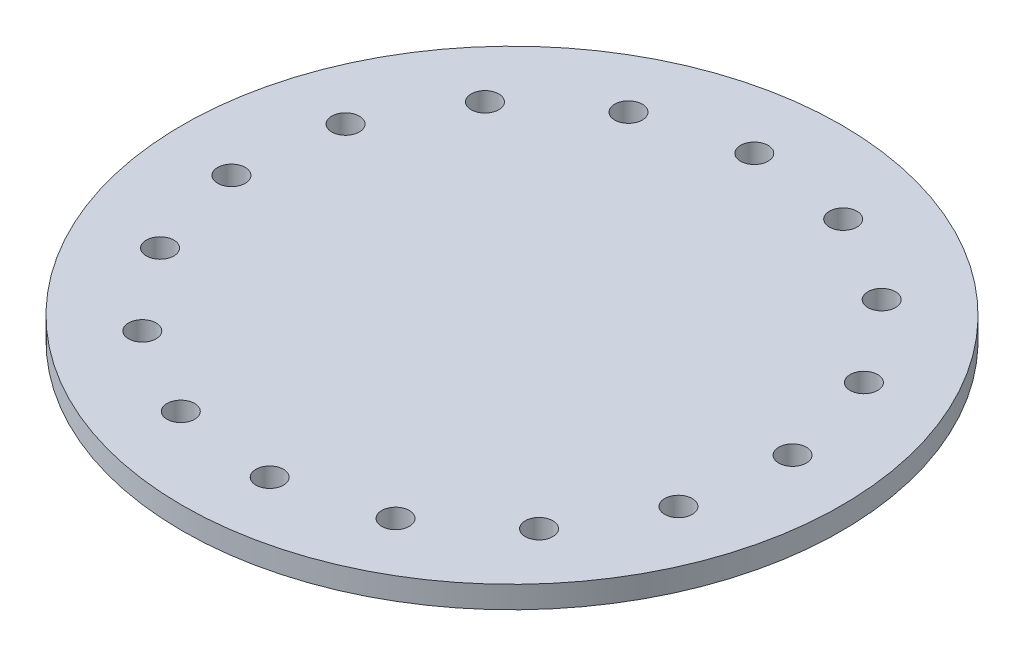
from build123d import *

# Parameters (mm, degrees)
SKETCH1_R               = 29.86111111
BOSS_EXTRUDE1_DEPTH     = 1
CUT_EXTRUDE1_DEPTH      = 43.277321503
CUT_EXTRUDE1_DEPTH_BACK = 43.277321503
SKETCH2_R               = 1.25


with BuildPart() as part:
    # Sketch1 → Boss-Extrude1 (new, symmetric)
    with BuildSketch(Plane(origin=(0, 0, 0), x_dir=(1, 0, 0), z_dir=(0, 1, 0))):
        with Locations(Location((0, 0, 0), (0, 0, 270))):
            Circle(SKETCH1_R)
    extrude(amount=BOSS_EXTRUDE1_DEPTH, both=True)

    # Sketch2 → Cut-Extrude1 (cut, two sides: drawn at the far end of the back side and taken through both)
    with BuildSketch(Plane(origin=(0, 1, 0), x_dir=(1, 0, 0), z_dir=(0, 1, 0)).offset(-CUT_EXTRUDE1_DEPTH_BACK)):
        with Locations(Location((1.733610724, -23.686643786, 0), (0, 0, 270))):
            Circle(SKETCH2_R)
        with Locations(Location((-7.46283868, -22.54702949, 0), (0, 0, 270))):
            Circle(SKETCH2_R)
        with Locations(Location((-15.523138546, -17.974834344, 0), (0, 0, 270))):
            Circle(SKETCH2_R)
        with Locations(Location((-21.220181286, -10.66613361, 0), (0, 0, 270))):
            Circle(SKETCH2_R)
        with Locations(Location((-23.686643786, -1.733610724, 0), (0, 0, 270))):
            Circle(SKETCH2_R)
        with Locations(Location((-22.54702949, 7.46283868, 0), (0, 0, 270))):
            Circle(SKETCH2_R)
        with Locations(Location((-17.974834344, 15.523138546, 0), (0, 0, 270))):
            Circle(SKETCH2_R)
        with Locations(Location((-10.66613361, 21.220181286, 0), (0, 0, 270))):
            Circle(SKETCH2_R)
        with Locations(Location((-1.733610724, 23.686643786, 0), (0, 0, 270))):
            Circle(SKETCH2_R)
        with Locations(Location((10.66613361, -21.220181286, 0), (0, 0, 270))):
            Circle(SKETCH2_R)
        with Locations(Location((17.974834344, -15.523138546, 0), (0, 0, 270))):
            Circle(SKETCH2_R)
        with Locations(Location((22.54702949, -7.46283868, 0), (0, 0, 270))):
            Circle(SKETCH2_R)
        with Locations(Location((23.686643786, 1.733610724, 0), (0, 0, 270))):
            Circle(SKETCH2_R)
        with Locations(Location((21.220181286, 10.66613361, 0), (0, 0, 270))):
            Circle(SKETCH2_R)
        with Locations(Location((15.523138546, 17.974834344, 0), (0, 0, 270))):
            Circle(SKETCH2_R)
        with Locations(Location((7.46283868, 22.54702949, 0), (0, 0, 270))):
            Circle(SKETCH2_R)
    extrude(amount=CUT_EXTRUDE1_DEPTH + CUT_EXTRUDE1_DEPTH_BACK, mode=Mode.SUBTRACT)


solid = part.part
